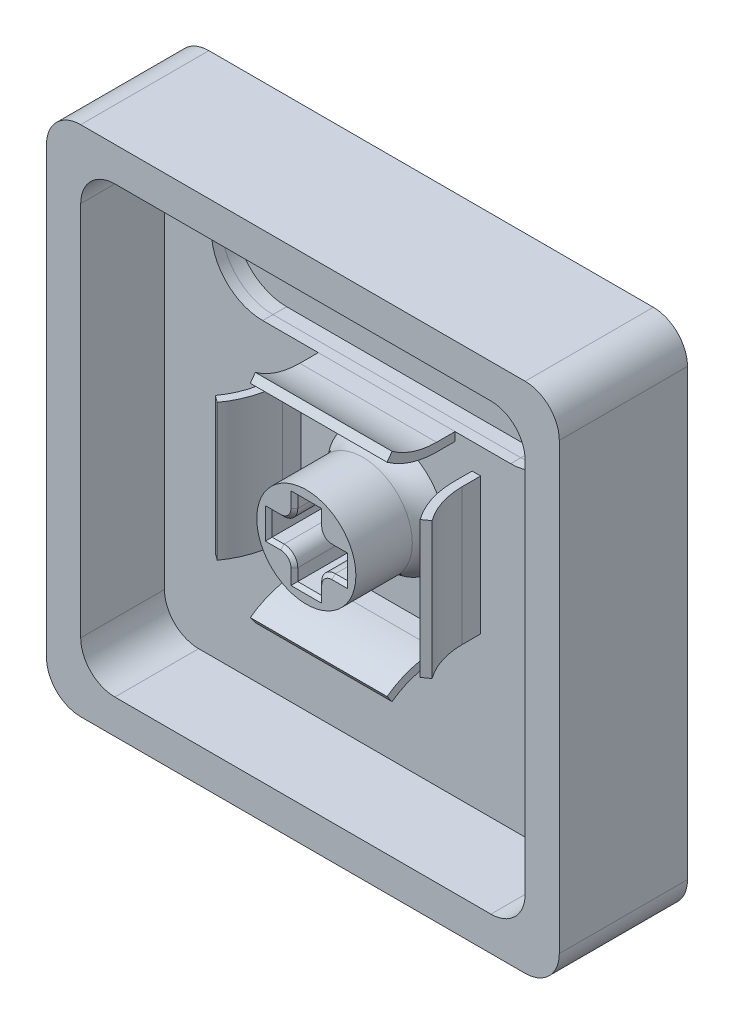
from build123d import *

# Parameters (mm, degrees)
EXTRUDE_1_DEPTH          = 5.5
SKETCH_1_6_R             = 2.9
EXTRUDE_2_DEPTH          = 5.3
EXTRUDE_START            = -2
EXTRUDE_3_DEPTH          = 2
EXTRUDE_4_DEPTH          = 2
CUT_EXTRUDE_1_REACH      = 23.915
EXTRUDE_6_DEPTH          = 1.2
EXTRUDE_9_DEPTH          = 4
FILLET_4_R               = 0.8
CHAMFER_1_SIZE           = 0.2
FILLET_5_R               = 2
EXTRUDE_10_DEPTH         = 0.6
PATTERN_CIRCULAR_6_COUNT = 4


with BuildPart() as part:
    # 草图1 → 凸台-拉伸1 (new body)
    with BuildSketch(Plane.XY):
        with BuildLine():
            ThreePointArc((-15, 13), (-14.414213562, 14.414213562), (-13, 15))
            Line((-13, 15), (13, 15))
            ThreePointArc((13, 15), (14.414213562, 14.414213562), (15, 13))
            Line((15, 13), (15, -13))
            ThreePointArc((15, -13), (14.414213562, -14.414213562), (13, -15))
            Line((13, -15), (-13, -15))
            ThreePointArc((-13, -15), (-14.414213562, -14.414213562), (-15, -13))
            Line((-15, -13), (-15, 13))
        make_face()
        with BuildLine():
            ThreePointArc((-13, -11), (-12.414213562, -12.414213562), (-11, -13))
            Line((-11, -13), (11, -13))
            ThreePointArc((11, -13), (12.414213562, -12.414213562), (13, -11))
            Line((13, -11), (13, 11))
            ThreePointArc((13, 11), (12.414213562, 12.414213562), (11, 13))
            Line((11, 13), (-11, 13))
            ThreePointArc((-11, 13), (-12.414213562, 12.414213562), (-13, 11))
            Line((-13, 11), (-13, -11))
        make_face(mode=Mode.SUBTRACT)
    extrude(amount=EXTRUDE_1_DEPTH)



with BuildPart() as body_2:
    # 草图1<6> → 凸台-拉伸2 (new body)
    with BuildSketch(Plane.XY):
        Circle(SKETCH_1_6_R)
        Polygon((-2.2, -0.7), (-2.2, 0.7), (-0.7, 0.7), (-0.7, 2.2), (0.7, 2.2), (0.7, 0.7), (2.2, 0.7), (2.2, -0.7), (0.7, -0.7), (0.7, -2.2), (-0.7, -2.2), (-0.7, -0.7), align=None, mode=Mode.SUBTRACT)
    extrude(amount=EXTRUDE_2_DEPTH)


with BuildPart() as part_1:
    add(part.part)

    add(body_2.part)  # 凸台-拉伸3 merges body 2
    # 草图1<7> → 凸台-拉伸3 (add)
    with BuildSketch(Plane.XY.offset(EXTRUDE_START)):
        with BuildLine():
            Line((-13, 15), (13, 15))
            ThreePointArc((13, 15), (14.414213562, 14.414213562), (15, 13))
            Line((15, 13), (15, -13))
            ThreePointArc((15, -13), (14.414213562, -14.414213562), (13, -15))
            Line((13, -15), (-13, -15))
            ThreePointArc((-13, -15), (-14.414213562, -14.414213562), (-15, -13))
            Line((-15, -13), (-15, 13))
            ThreePointArc((-15, 13), (-14.414213562, 14.414213562), (-13, 15))
        make_face()
    extrude(amount=EXTRUDE_3_DEPTH)

    # 草图3 → 凸台-拉伸4 (add)
    with BuildSketch(Plane.XY):
        Polygon((0.7, 0.7), (0.7, 2.2), (-0.7, 2.2), (-0.7, 0.7), (-2.2, 0.7), (-2.2, -0.7), (-0.7, -0.7), (-0.7, -2.2), (0.7, -2.2), (0.7, -0.7), (2.2, -0.7), (2.2, 0.7), align=None)
    extrude(amount=EXTRUDE_4_DEPTH)

    # 草图5 → 切除-拉伸1 (cut, up to next)
    with BuildSketch(Plane.XY, mode=Mode.PRIVATE) as cut_extrude_1_sk1:
        with BuildLine():
            Line((7.25, 5.5), (-7.25, 5.5))
            ThreePointArc((-7.25, 5.5), (-10.25, 8.5), (-7.25, 11.5))
            Line((-7.25, 11.5), (7.25, 11.5))
            ThreePointArc((7.25, 11.5), (10.25, 8.5), (7.25, 5.5))
        make_face()
    cut_extrude_1_tool1 = extrude(cut_extrude_1_sk1.sketch, amount=-CUT_EXTRUDE_1_REACH, mode=Mode.PRIVATE) & part_1.part
    add(cut_extrude_1_tool1.solids().sort_by_distance((0, 8.5, 0))[0], mode=Mode.SUBTRACT)

    # 圆角4
    fillet_4_edges = [part_1.edges().sort_by_distance(p)[0] for p in [
        (0.7, 0.7, 3.65),
        (0.7, -0.7, 3.65),
        (-0.7, -0.7, 3.65),
        (-0.7, 0.7, 3.65),
    ]]
    fillet(fillet_4_edges, radius=FILLET_4_R)

    # 倒角1
    chamfer_1_edges = [part_1.edges().sort_by_distance(p)[0] for p in [
        (1.85, 0.7, 5.3),
        (1.85, -0.7, 5.3),
        (0.7, -1.85, 5.3),
        (-0.7, -1.85, 5.3),
        (0.934314575, -0.934314575, 5.3),
        (-0.934314575, -0.934314575, 5.3),
        (0.934314575, 0.934314575, 5.3),
        (-0.934314575, 0.934314575, 5.3),
        (0, -2.2, 5.3),
        (-1.85, -0.7, 5.3),
        (-2.2, 0, 5.3),
        (-0.7, 1.85, 5.3),
        (0, 2.2, 5.3),
        (0.7, 1.85, 5.3),
        (2.2, 0, 5.3),
        (-1.85, 0.7, 5.3),
    ]]
    chamfer(chamfer_1_edges, length=CHAMFER_1_SIZE)

    # 圆角5
    fillet_5_edges = [part_1.edges().sort_by_distance(p)[0] for p in [
        (-2.9, 0, 0),
    ]]
    fillet(fillet_5_edges, radius=FILLET_5_R)


with BuildPart() as body_2_2:
    # 草图6 → 凸台-拉伸6 (new body)
    with BuildSketch(Plane(origin=(0, 0, -2), x_dir=(-1, 0, 0), z_dir=(0, 0, -1))):
        with BuildLine():
            Line((7.25, 5.5), (-7.25, 5.5))
            ThreePointArc((-7.25, 5.5), (-10.25, 8.5), (-7.25, 11.5))
            Line((-7.25, 11.5), (7.25, 11.5))
            ThreePointArc((7.25, 11.5), (10.25, 8.5), (7.25, 5.5))
        make_face()
    extrude(amount=-EXTRUDE_6_DEPTH)


with BuildPart() as body_3:
    # 草图9 → 凸台-拉伸9 (new, symmetric)
    with BuildSketch(Plane(origin=(0, 0, 0), x_dir=(1, 0, 0), z_dir=(0, 1, 0))):
        with BuildLine():
            Line((5.93522135, -4.576441313), (6.340698731, -4.283886885))
            ThreePointArc((6.340698731, -4.283886885), (5.715390829, -3.049095715), (5.5, -1.681862744))
            Line((5.5, -1.681862744), (5.5, 1.163381533))
            Line((5.5, 1.163381533), (5, 1.163381533))
            Line((5, 1.163381533), (5, -1.681862744))
            ThreePointArc((5, -1.681862744), (5.239607953, -3.20281837), (5.93522135, -4.576441313))
        make_face()
    extrude(amount=EXTRUDE_9_DEPTH, both=True)


with BuildPart() as body_4:
    # 草图10 → 凸台-拉伸10 (new body)
    with BuildSketch(Plane.XY):
        with BuildLine():
            Line((-13, 11), (-13, -11))
            ThreePointArc((-13, -11), (-12.414213562, -12.414213562), (-11, -13))
            Line((-11, -13), (11, -13))
            ThreePointArc((11, -13), (12.414213562, -12.414213562), (13, -11))
            Line((13, -11), (13, 11))
            ThreePointArc((13, 11), (12.414213562, 12.414213562), (11, 13))
            Line((11, 13), (-11, 13))
            ThreePointArc((-11, 13), (-12.414213562, 12.414213562), (-13, 11))
        make_face()
        with BuildLine():
            Line((7.25, 5.5), (-7.25, 5.5))
            ThreePointArc((-7.25, 5.5), (-10.25, 8.5), (-7.25, 11.5))
            Line((-7.25, 11.5), (7.25, 11.5))
            ThreePointArc((7.25, 11.5), (10.25, 8.5), (7.25, 5.5))
        make_face(mode=Mode.SUBTRACT)
    extrude(amount=EXTRUDE_10_DEPTH)


with BuildPart() as pattern_circular_6_1:
    # 阵列(圆周)6: pattern copy
    add(body_3.part.rotate(Axis((0, 0, 0), (0, 0, 1)), 1 * 360 / PATTERN_CIRCULAR_6_COUNT))


with BuildPart() as pattern_circular_6_2:
    # 阵列(圆周)6: pattern copy
    add(body_3.part.rotate(Axis((0, 0, 0), (0, 0, 1)), 2 * 360 / PATTERN_CIRCULAR_6_COUNT))


with BuildPart() as pattern_circular_6_3:
    # 阵列(圆周)6: pattern copy
    add(body_3.part.rotate(Axis((0, 0, 0), (0, 0, 1)), 3 * 360 / PATTERN_CIRCULAR_6_COUNT))


solid = Compound([part_1.part, body_2_2.part, body_3.part, body_4.part, pattern_circular_6_1.part, pattern_circular_6_2.part, pattern_circular_6_3.part])
